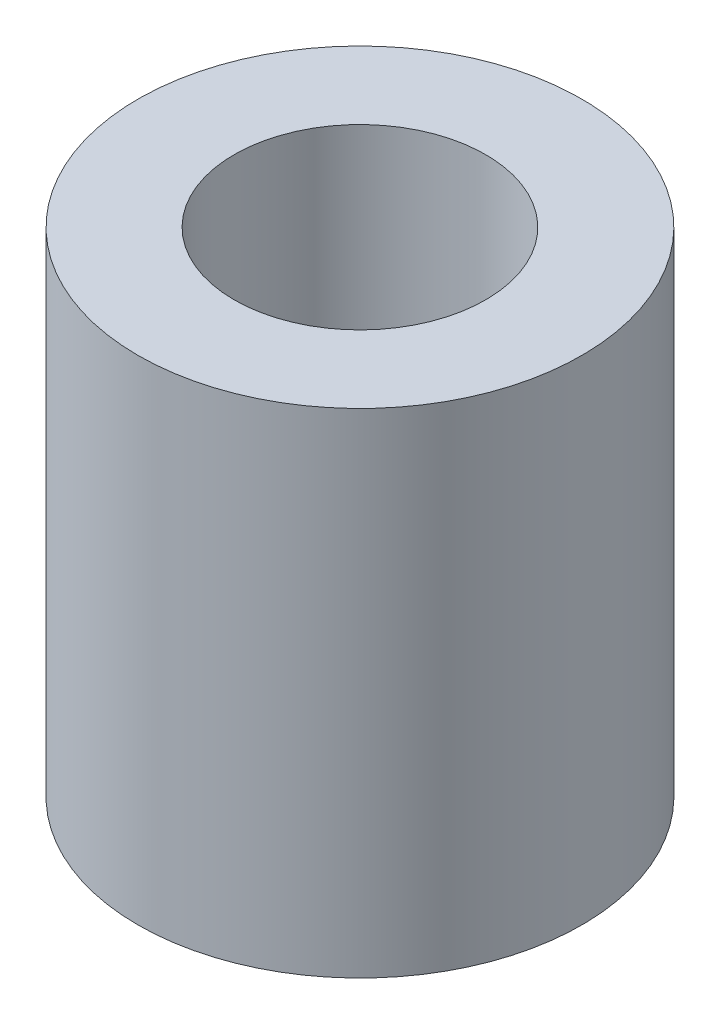
from build123d import *

# Parameters (mm, degrees)
SKETCH1_R           = 4.5
SKETCH1_R_2         = 2.55
BOSS_EXTRUDE1_DEPTH = 10


with BuildPart() as part:
    # Sketch1 → Boss-Extrude1 (new body)
    with BuildSketch(Plane(origin=(0, 0, 0), x_dir=(1, 0, 0), z_dir=(0, 1, 0))):
        with Locations(Location((0, 0, 0), (0, 0, 270))):
            Circle(SKETCH1_R)
        with Locations(Location((0, 0, 0), (0, 0, 270))):
            Circle(SKETCH1_R_2, mode=Mode.SUBTRACT)
    extrude(amount=BOSS_EXTRUDE1_DEPTH)


solid = part.part
